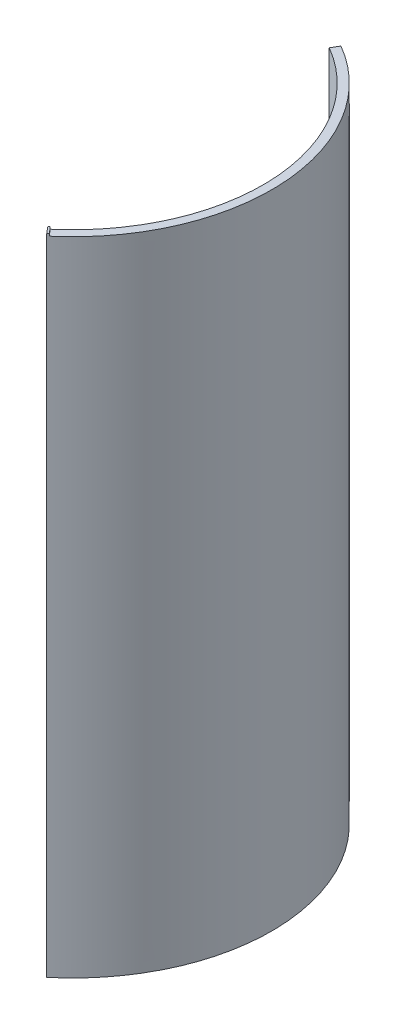
from build123d import *

# Parameters (mm, degrees)
BOSS_EXTRUDE1_DEPTH = 150
BOSS_EXTRUDE2_DEPTH = 0.5


with BuildPart() as part:
    # Sketch2 → Boss-Extrude1 (new body)
    with BuildSketch(Plane(origin=(0, 0, 0), x_dir=(1, 0, 0), z_dir=(0, 1, 0))):
        with BuildLine():
            Line((23.797062321, 33.213285148), (22.795142151, 31.482344371))
            add(Edge.make_bspline(
                [(22.795142151, 31.482344371), (24.030753055, 30.767135912), (25.233639686, 29.979607721), (28.216264815, 27.780060074), (29.936056862, 26.267235672), (33.113180479, 22.936872084), (34.570445154, 21.119364941), (37.168337692, 17.22581337), (38.308904588, 15.14981295), (40.227461412, 10.795097875), (41.005398438, 8.516438081), (42.162707814, 3.820385091), (42.542037254, 1.403056115), (42.877540716, -3.499989055), (42.833683466, -5.985633503), (42.310738689, -10.950645077), (41.831632837, -13.429935053), (40.439380604, -18.305496801), (39.526229768, -20.701688368), (37.280686856, -25.334605804), (35.948304685, -27.571250912), (32.892627712, -31.811345756), (31.169357216, -33.814716752), (28.41621102, -36.50174018), (27.525653213, -37.305652913), (26.602067896, -38.076133183)],
                knots=[0.542561249, 0.542561249, 0.542561249, 0.542561249, 0.5625, 0.5625, 0.59375, 0.59375, 0.625, 0.625, 0.65625, 0.65625, 0.6875, 0.6875, 0.71875, 0.71875, 0.75, 0.75, 0.78125, 0.78125, 0.8125, 0.8125, 0.84375, 0.84375, 0.875, 0.875, 0.889078422, 0.889078422, 0.889078422, 0.889078422], degree=3))
            Line((26.602067896, -38.076133183), (27.883246949, -39.611900168))
            add(Edge.make_bspline(
                [(23.797062321, 33.213285148), (24.815377843, 32.623853739), (26.80926599, 31.351927329), (31.798717541, 27.519992265), (38.576174784, 19.988985752), (44.368236596, 6.937105842), (45.478441885, -8.69346018), (41.121486558, -24.100915816), (34.386646993, -33.572491638), (29.466000561, -38.252286288), (28.417890699, -39.16588565), (27.883246949, -39.611900168)],
                knots=[0.542561249, 0.542561249, 0.542561249, 0.542561249, 0.558186249, 0.573811249, 0.625, 0.6875, 0.75, 0.8125, 0.873453422, 0.881265922, 0.889078422, 0.889078422, 0.889078422, 0.889078422], degree=3))
        make_face()
    extrude(amount=BOSS_EXTRUDE1_DEPTH)

    # Sketch3 → Boss-Extrude2 (add)
    with BuildSketch(Plane(origin=(0, 150, 0), x_dir=(1, 0, 0), z_dir=(0, 1, 0))):
        with BuildLine():
            Line((28.205343741, -39.340806389), (26.910813356, -37.816280265))
            add(Edge.make_bspline(
                [(26.910813356, -37.816280265), (26.808313881, -37.90331377), (26.705397589, -37.989932711), (26.602067896, -38.076133183)],
                knots=[0.887503344, 0.887503344, 0.887503344, 0.887503344, 0.889078422, 0.889078422, 0.889078422, 0.889078422], degree=3))
            Line((26.602067896, -38.076133183), (27.883246949, -39.611900168))
            add(Edge.make_bspline(
                [(27.883246949, -39.611900168), (27.991044203, -39.521972735), (28.098410996, -39.431606859), (28.205343741, -39.340806389)],
                knots=[0.542561249, 0.542561249, 0.542561249, 0.542561249, 0.54413644, 0.54413644, 0.54413644, 0.54413644], degree=3))
        make_face()
    extrude(amount=BOSS_EXTRUDE2_DEPTH)


solid = part.part
